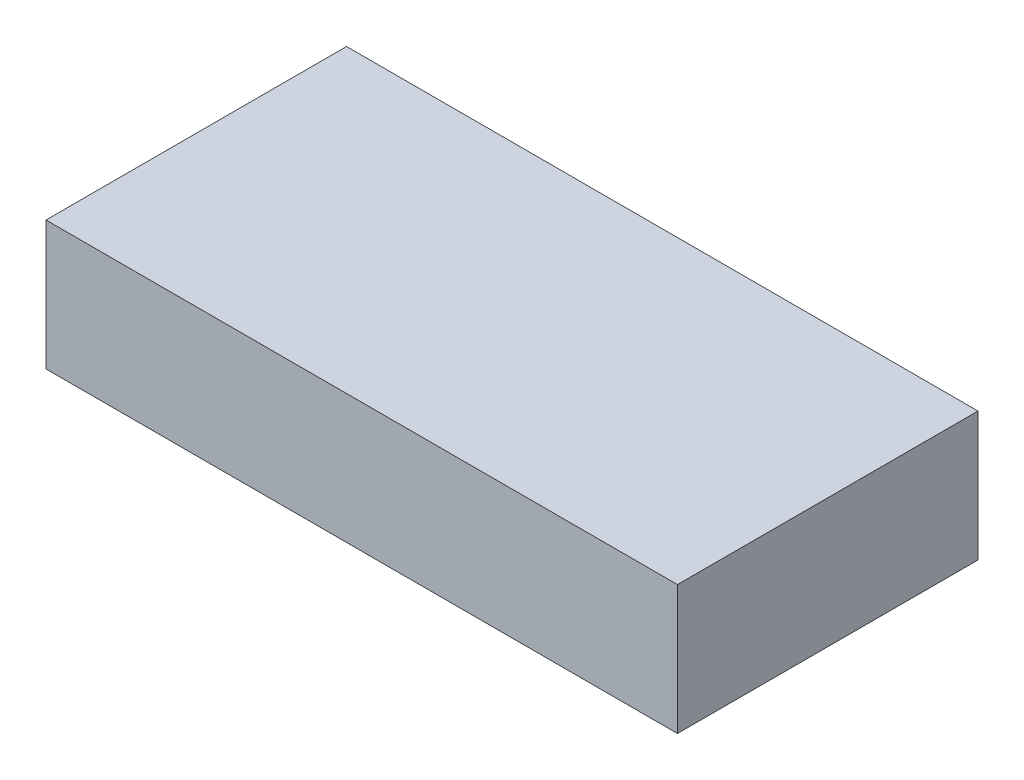
from build123d import *

# Parameters (mm, degrees)
SKETCH1_W           = 97.90721761
SKETCH1_H           = 46.600763908
BOSS_EXTRUDE1_DEPTH = 20
CUT_EXTRUDE1_DEPTH  = 90
CUT_EXTRUDE3_DEPTH  = 90


with BuildPart() as part:
    # Sketch1 → Boss-Extrude1 (new body)
    with BuildSketch(Plane(origin=(0, 0, 0), x_dir=(1, 0, 0), z_dir=(0, 1, 0))):
        Rectangle(SKETCH1_W, SKETCH1_H)
    extrude(amount=BOSS_EXTRUDE1_DEPTH)

    # Sketch3 → Cut-Extrude1 (cut)
    with BuildSketch(Plane.ZY.offset(48.953608805)):
        Polygon((0, 10), (-10.601673789, 14.55), (-17.105, 14.55), (-17.105, 5.45), (-10.601673789, 5.45), align=None)
        Polygon((10.601673789, 14.55), (-10.601673789, 14.55), (0, 10), align=None)
        Polygon((10.601673789, 5.45), (0, 10), (-10.601673789, 5.45), align=None)
        Polygon((10.601673789, 14.55), (0, 10), (10.601673789, 5.45), (17.105, 5.45), (17.105, 14.55), align=None)
    extrude(amount=-CUT_EXTRUDE1_DEPTH, mode=Mode.SUBTRACT)

    # Sketch4 → Cut-Extrude3 (cut)
    with BuildSketch(Plane.ZY.offset(48.953608805)):
        Polygon((-14.105, 4.45), (-14.105, 2.45), (14.105, 2.45), (14.105, 4.45), (17.955, 4.45), (17.955, 14.55), (17.105, 14.55), (17.105, 5.45), (-17.105, 5.45), (-17.105, 14.55), (-17.955, 14.55), (-17.955, 4.45), align=None)
    extrude(amount=-CUT_EXTRUDE3_DEPTH, mode=Mode.SUBTRACT)


solid = part.part
